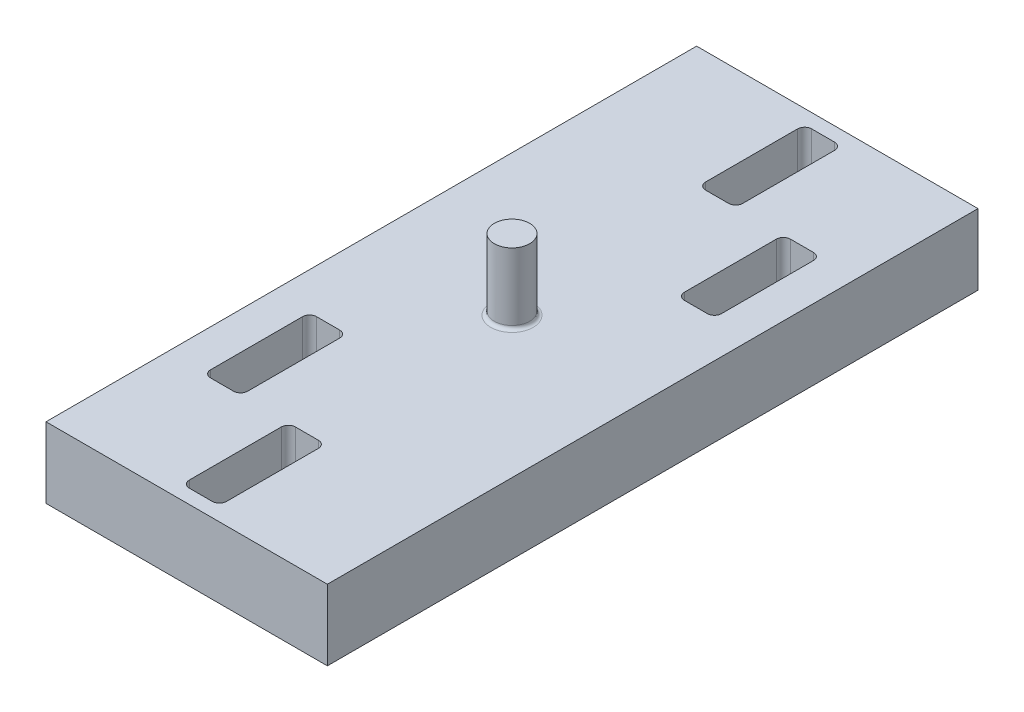
from build123d import *

# Parameters (mm, degrees)
BOSS_EXTRUDE1_DEPTH  = 10
FILLET2_R            = 1
FILLET2_OF_MIRROR1_R = 1
CUT_EXTRUDE1_DEPTH   = 81.635062113
FILLET3_R            = 1
SKETCH5_R            = 2.5
BOSS_EXTRUDE2_DEPTH  = 10
FILLET1_R            = 0.5


with BuildPart() as part:
    # Sketch2 → Boss-Extrude1 (new body)
    with BuildSketch(Plane(origin=(0, 0, 0), x_dir=(1, 0, 0), z_dir=(0, 1, 0))):
        Polygon((-19.893799085, 77.5), (0, 77.5), (0, 75.5), (-2.625, 75.5), (-2.625, 73), (-2.625, 63), (-2.625, 60.5), (0, 60.5), (0, 60.375), (0, 2.5), (-2.625, 2.5), (-2.625, 0), (-2.625, -10), (-2.625, -12.5), (0, -12.5), (0, -14.5), (-19.893799085, -14.5), align=None)
    boss_extrude1 = extrude(amount=BOSS_EXTRUDE1_DEPTH)

    # Fillet2
    fillet2_edges = [part.edges().sort_by_distance(p)[0] for p in [
        (-2.625, 5, 12.5),
        (-2.625, 5, -2.5),
        (-2.625, 5, -60.5),
        (-2.625, 5, -75.5),
    ]]
    fillet(fillet2_edges, radius=FILLET2_R)

    # Mirror1: Boss-Extrude1 across Right Plane
    add(boss_extrude1.mirror(Plane(origin=(0, 0, 0), x_dir=(0, 0, -1), z_dir=(1, 0, 0))))

    # Fillet2 of Mirror1
    fillet2_of_mirror1_edges = [part.edges().sort_by_distance(p)[0] for p in [
        (2.625, 5, 12.5),
        (2.625, 5, -2.5),
        (2.625, 5, -60.5),
        (2.625, 5, -75.5),
    ]]
    fillet(fillet2_of_mirror1_edges, radius=FILLET2_OF_MIRROR1_R)

    # Sketch4 → Cut-Extrude1 (cut, through all)
    with BuildSketch(Plane(origin=(0, 0, 0), x_dir=(1, 0, 0), z_dir=(0, 1, 0))):
        Polygon((-14.625, 15), (-14.625, 5), (-14.625, 2.5), (-12, 2.5), (-9.375, 2.5), (-9.375, 5), (-9.375, 15), (-9.375, 17.5), (-12, 17.5), (-14.625, 17.5), align=None)
        Polygon((9.375, 58), (9.375, 48), (9.375, 45.5), (12, 45.5), (14.625, 45.5), (14.625, 48), (14.625, 58), (14.625, 60.5), (12, 60.5), (9.375, 60.5), align=None)
    extrude(amount=CUT_EXTRUDE1_DEPTH, mode=Mode.SUBTRACT)

    # Fillet3
    fillet3_edges = [part.edges().sort_by_distance(p)[0] for p in [
        (-14.625, 5, -17.5),
        (-14.625, 5, -2.5),
        (-9.375, 5, -2.5),
        (-9.375, 5, -17.5),
        (14.625, 5, -60.5),
        (9.375, 5, -60.5),
        (9.375, 5, -45.5),
        (14.625, 5, -45.5),
    ]]
    fillet(fillet3_edges, radius=FILLET3_R)

    # Sketch5 → Boss-Extrude2 (add)
    with BuildSketch(Plane(origin=(0, 10, 0), x_dir=(1, 0, 0), z_dir=(0, 1, 0))):
        with Locations(Location((0, 31.5, 0), (0, 0, 90))):
            Circle(SKETCH5_R)
    extrude(amount=BOSS_EXTRUDE2_DEPTH)

    # Fillet1
    fillet1_edges = [part.edges().sort_by_distance(p)[0] for p in [
        (0, 10, -29),
    ]]
    fillet(fillet1_edges, radius=FILLET1_R)


solid = part.part
